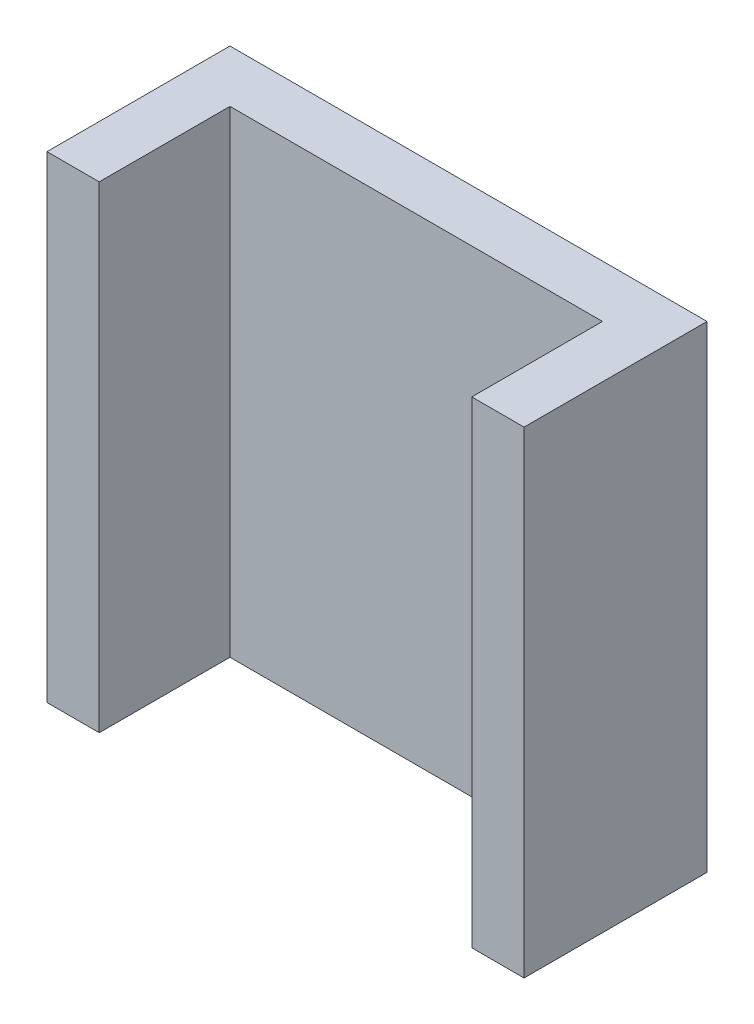
from build123d import *

# Parameters (mm, degrees)
ESQUISSE1_W        = 73
ESQUISSE1_H        = 73
BOSS_EXTRU_1_DEPTH = 8
ESQUISSE2_W        = 8
ESQUISSE2_H        = 73
BOSS_EXTRU_2_DEPTH = 20


with BuildPart() as part:
    # Esquisse1 → Boss.-Extru.1 (new body)
    with BuildSketch(Plane.XY):
        with Locations((36.5, 36.5)):
            Rectangle(ESQUISSE1_W, ESQUISSE1_H)
    extrude(amount=BOSS_EXTRU_1_DEPTH)

    # Esquisse2 → Boss.-Extru.2 (add)
    with BuildSketch(Plane.XY.offset(8)):
        with Locations((4, 36.5)):
            Rectangle(ESQUISSE2_W, ESQUISSE2_H)
        with Locations((69, 36.5)):
            Rectangle(ESQUISSE2_W, ESQUISSE2_H)
    extrude(amount=BOSS_EXTRU_2_DEPTH)


solid = part.part
